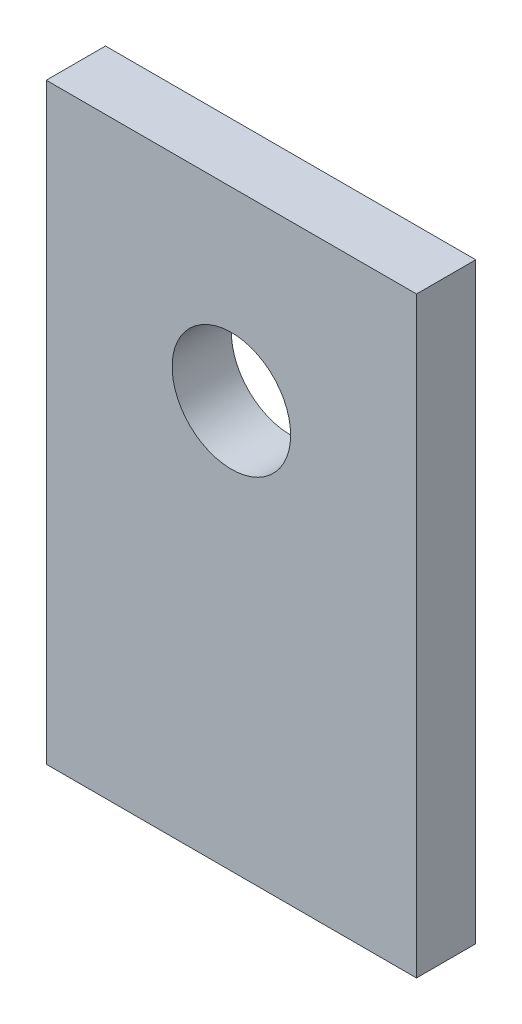
from build123d import *

# Parameters (mm, degrees)
SKETCH3_W           = 25
SKETCH3_H           = 40
SKETCH3_R           = 4
BOSS_EXTRUDE1_DEPTH = 4


with BuildPart() as part:
    # Sketch3 → Boss-Extrude1 (new body)
    with BuildSketch(Plane.XY):
        Rectangle(SKETCH3_W, SKETCH3_H)
        with Locations((0, 7.5)):
            Circle(SKETCH3_R, mode=Mode.SUBTRACT)
    extrude(amount=BOSS_EXTRUDE1_DEPTH)


solid = part.part
